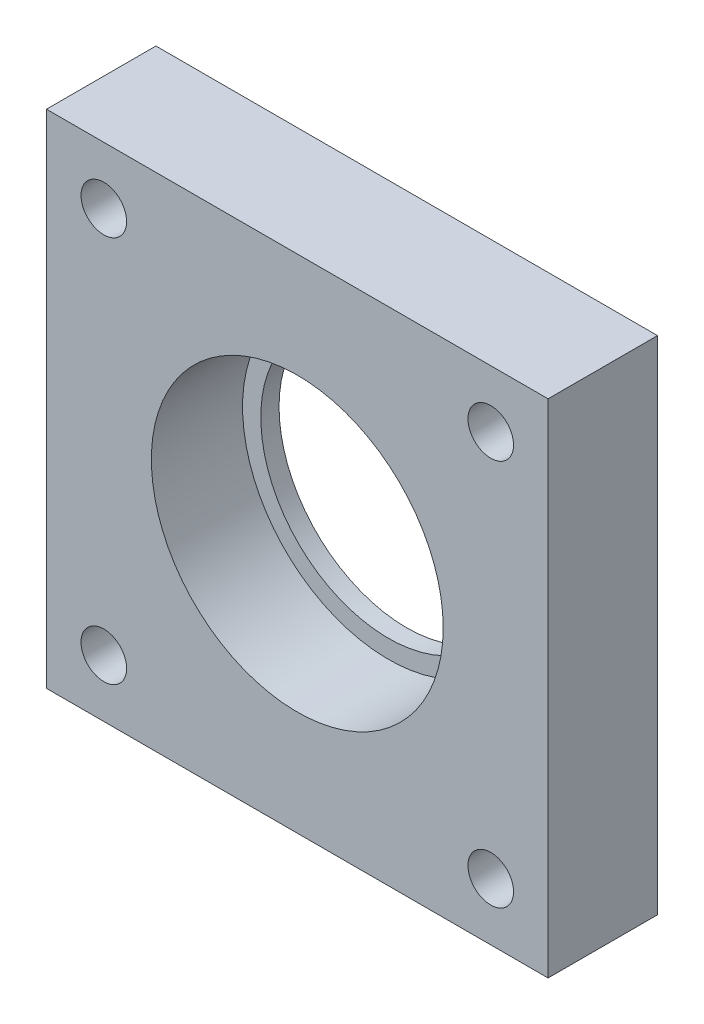
from build123d import *

# Parameters (mm, degrees)
SCHIZZO1_W                   = 55
SCHIZZO1_H                   = 55
ESTRUSIONE_ESTRUSIONE1_DEPTH = 12
SCHIZZO2_R                   = 16
TAGLIO_ESTRUSIONE1_DEPTH     = 10
SCHIZZO3_R                   = 14
TAGLIO_ESTRUSIONE2_DEPTH     = 10
SCHIZZO4_R                   = 2.5
TAGLIO_ESTRUSIONE3_DEPTH     = 79.70196948


with BuildPart() as part:
    # Schizzo1 → Estrusione-Estrusione1 (new body)
    with BuildSketch(Plane.XY):
        with Locations((27.5, 27.5)):
            Rectangle(SCHIZZO1_W, SCHIZZO1_H)
    extrude(amount=-ESTRUSIONE_ESTRUSIONE1_DEPTH)

    # Schizzo2 → Taglio-Estrusione1 (cut)
    with BuildSketch(Plane.XY):
        with Locations((27.5, 27.5)):
            Circle(SCHIZZO2_R)
    extrude(amount=-TAGLIO_ESTRUSIONE1_DEPTH, mode=Mode.SUBTRACT)

    # Schizzo3 → Taglio-Estrusione2 (cut)
    with BuildSketch(Plane.XY.offset(-10)):
        with Locations((27.5, 27.5)):
            Circle(SCHIZZO3_R)
    extrude(amount=-TAGLIO_ESTRUSIONE2_DEPTH, mode=Mode.SUBTRACT)

    # Schizzo4 → Taglio-Estrusione3 (cut, through all)
    with BuildSketch(Plane(origin=(0, 0, -12), x_dir=(-1, 0, 0), z_dir=(0, 0, -1))):
        with Locations((-48.713203436, 48.713203436)):
            Circle(SCHIZZO4_R)
        with Locations(Location((-6.286796564, 48.713203436, 0), (0, 0, 180))):
            Circle(SCHIZZO4_R)
        with Locations(Location((-48.713203436, 6.286796564, 0), (0, 0, 180))):
            Circle(SCHIZZO4_R)
        with Locations((-6.286796564, 6.286796564)):
            Circle(SCHIZZO4_R)
    extrude(amount=-TAGLIO_ESTRUSIONE3_DEPTH, mode=Mode.SUBTRACT)


solid = part.part
